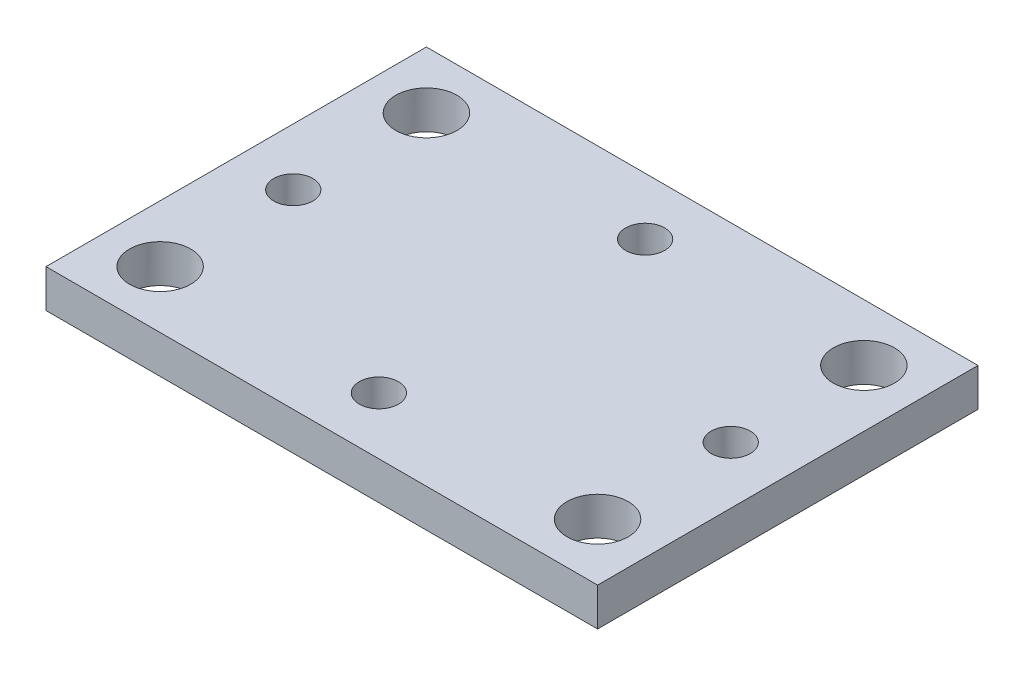
from build123d import *

# Parameters (mm, degrees)
SKETCH1_W              = 46.0375
SKETCH1_H              = 31.75
BOSS_EXTRUDE1_DEPTH    = 3.175
F_10_CLEARANCE_HOLE1_D = 5.1054
F_4_CLEARANCE_HOLE1_D  = 3.2639


with BuildPart() as part:
    # Sketch1 → Boss-Extrude1 (new body)
    with BuildSketch(Plane(origin=(0, 0, 0), x_dir=(1, 0, 0), z_dir=(0, 1, 0))):
        Rectangle(SKETCH1_W, SKETCH1_H)
    extrude(amount=BOSS_EXTRUDE1_DEPTH)

    # #10 Clearance Hole1 (through all)
    with Locations(Plane(origin=(0, 3.175, 0), x_dir=(1, 0, 0), z_dir=(0, 1, 0))):
        with Locations((-18.25625, 11.1125), (-18.25625, -11.1125), (18.25625, -11.1125), (18.25625, 11.1125)):
            Hole(F_10_CLEARANCE_HOLE1_D / 2)

    # #4 Clearance Hole1 (through all)
    with Locations(Plane(origin=(0, 3.175, 0), x_dir=(1, 0, 0), z_dir=(0, 1, 0))):
        with Locations((0, 11.1125), (0, -11.1125), (-18.25625, 0), (18.25625, 0)):
            Hole(F_4_CLEARANCE_HOLE1_D / 2)


solid = part.part
